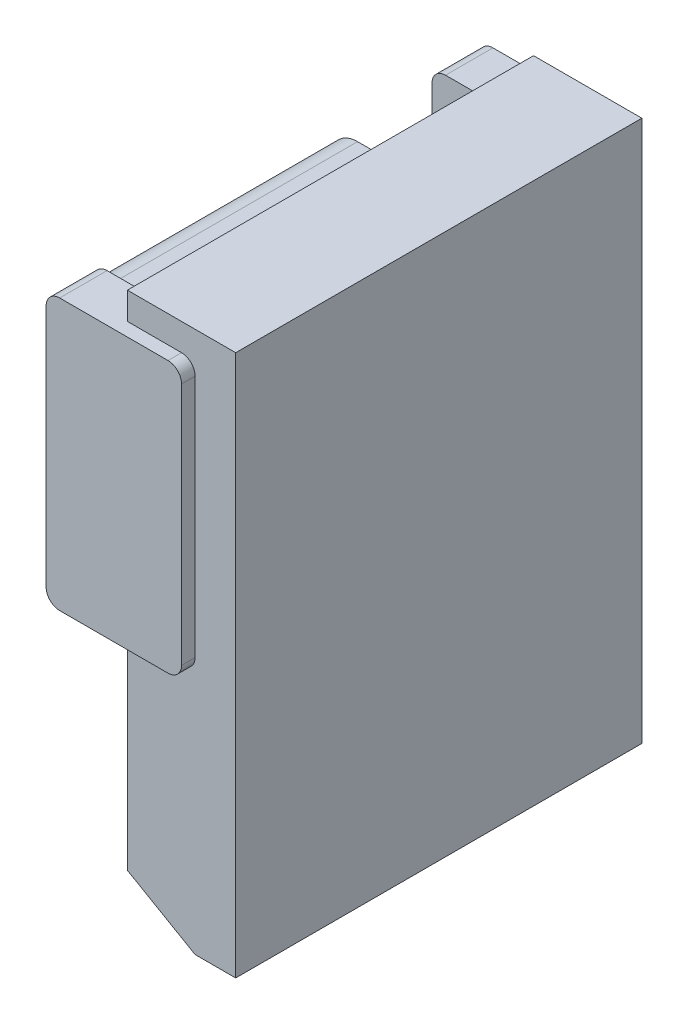
from build123d import *

# Parameters (mm, degrees)
EXTRUDE_1_DEPTH     = 15
SKETCH_7_W          = 10
SKETCH_7_H          = 12
SKETCH_7_W_2        = 4
SKETCH_7_H_2        = 4
CUT_EXTRUDE_1_DEPTH = 1
EXTRUDE_2_DEPTH     = 4.5
EXTRUDE_3_DEPTH     = 10
EXTRUDE_START       = 1
EXTRUDE_4_DEPTH     = 3.5


with BuildPart() as part:
    # 草图1 → 凸台-拉伸1 (new, symmetric)
    with BuildSketch(Plane.XY):
        Polygon((0, 0), (0, 40), (-8, 40), (-8, 2.886751346), (-3, 0), align=None)
    extrude(amount=EXTRUDE_1_DEPTH, both=True)

    # 草图7 → 切除-拉伸1 (cut)
    with BuildSketch(Plane.ZY.offset(8)):
        with Locations((0, 12)):
            Rectangle(SKETCH_7_W, SKETCH_7_H)
        with Locations((-10, 8)):
            Rectangle(SKETCH_7_W_2, SKETCH_7_H_2)
        with Locations((10, 8)):
            Rectangle(SKETCH_7_W_2, SKETCH_7_H_2)
    extrude(amount=-CUT_EXTRUDE_1_DEPTH, mode=Mode.SUBTRACT)

    # 草图9 → 凸台-拉伸2 (add, symmetric)
    with BuildSketch(Plane.XY):
        Polygon((-7, 14), (-8, 14), (-12, 13), (-12, 11), (-8, 10), (-7, 10), align=None)
    extrude(amount=EXTRUDE_2_DEPTH, both=True)

    # 草图15 → 凸台-拉伸3 (add, symmetric)
    with BuildSketch(Plane.XY):
        with BuildLine():
            Line((-8, 29), (-16, 29))
            ThreePointArc((-16, 29), (-18, 31), (-16, 33))
            Line((-16, 33), (-8, 33))
            ThreePointArc((-8, 33), (-6, 31), (-8, 29))
        make_face()
    extrude(amount=EXTRUDE_3_DEPTH, both=True)

    # 草图16 → 凸台-拉伸4 (add)
    with BuildSketch(Plane.XY.offset(15).offset(EXTRUDE_START)):
        with BuildLine():
            Line((-4, 18), (-12, 18))
            ThreePointArc((-12, 18), (-12.707106781, 18.292893219), (-13, 19))
            Line((-13, 19), (-13, 37))
            ThreePointArc((-13, 37), (-12.707106781, 37.707106781), (-12, 38))
            Line((-12, 38), (-4, 38))
            ThreePointArc((-4, 38), (-3.292893219, 37.707106781), (-3, 37))
            Line((-3, 37), (-3, 19))
            ThreePointArc((-3, 19), (-3.292893219, 18.292893219), (-4, 18))
        make_face()
    extrude_4 = extrude(amount=-EXTRUDE_4_DEPTH)

    # 镜向1: 凸台-拉伸4 across plane
    add(extrude_4.mirror(Plane.XY))


solid = part.part
